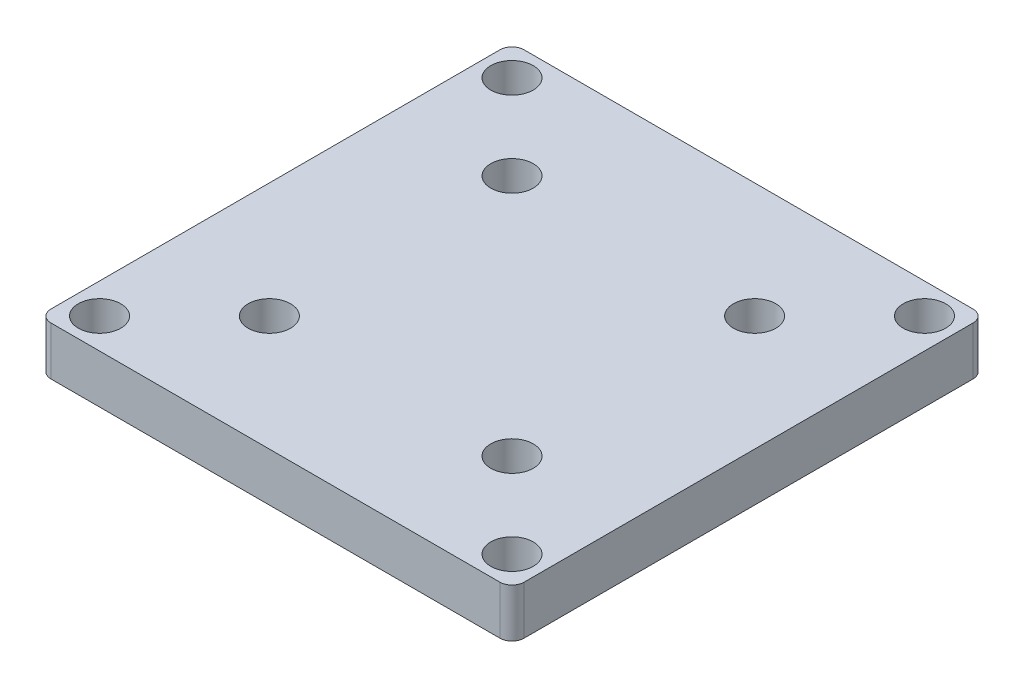
from build123d import *

# Parameters (mm, degrees)
SKETCH1_W           = 39
SKETCH1_H           = 39
SKETCH1_R           = 1.75
BOSS_EXTRUDE1_DEPTH = 4
SKETCH2_R           = 1.75
CUT_EXTRUDE1_DEPTH  = 11
FILLET1_R           = 1


with BuildPart() as part:
    # Sketch1 → Boss-Extrude1 (new body)
    with BuildSketch(Plane(origin=(0, 0, 0), x_dir=(1, 0, 0), z_dir=(0, 1, 0))):
        Rectangle(SKETCH1_W, SKETCH1_H)
        with Locations(Location((17, 17, 0), (0, 0, 270))):
            Circle(SKETCH1_R, mode=Mode.SUBTRACT)
        with Locations(Location((17, -17, 0), (0, 0, 270))):
            Circle(SKETCH1_R, mode=Mode.SUBTRACT)
        with Locations(Location((-17, -17, 0), (0, 0, 270))):
            Circle(SKETCH1_R, mode=Mode.SUBTRACT)
        with Locations(Location((-17, 17, 0), (0, 0, 270))):
            Circle(SKETCH1_R, mode=Mode.SUBTRACT)
    extrude(amount=BOSS_EXTRUDE1_DEPTH)

    # Sketch2 → Cut-Extrude1 (cut)
    with BuildSketch(Plane(origin=(0, 4, 0), x_dir=(1, 0, 0), z_dir=(0, 1, 0))):
        with Locations(Location((10, 10, 0), (0, 0, 270))):
            Circle(SKETCH2_R)
        with Locations(Location((10, -10, 0), (0, 0, 270))):
            Circle(SKETCH2_R)
        with Locations(Location((-10, -10, 0), (0, 0, 270))):
            Circle(SKETCH2_R)
        with Locations(Location((-10, 10, 0), (0, 0, 270))):
            Circle(SKETCH2_R)
    extrude(amount=-CUT_EXTRUDE1_DEPTH, mode=Mode.SUBTRACT)

    # Fillet1
    fillet1_edges = [part.edges().sort_by_distance(p)[0] for p in [
        (19.5, 2, 19.5),
        (-19.5, 2, 19.5),
        (-19.5, 2, -19.5),
        (19.5, 2, -19.5),
    ]]
    fillet(fillet1_edges, radius=FILLET1_R)


solid = part.part
